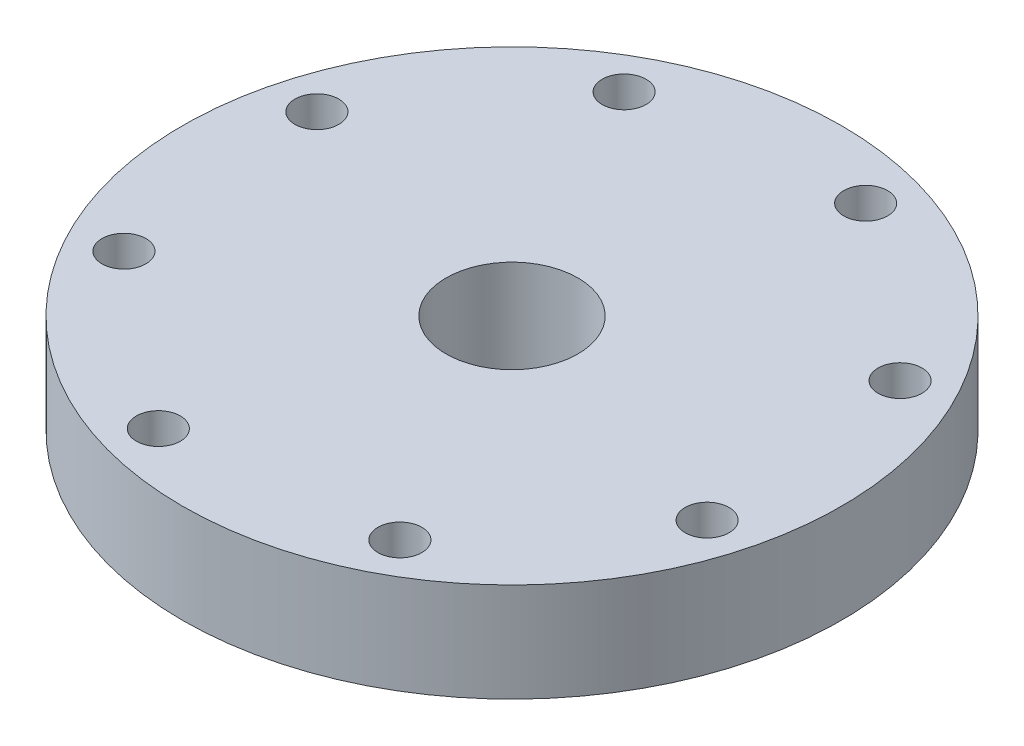
from build123d import *

# Parameters (mm, degrees)
SKETCH_1_R          = 15
EXTRUDE_1_DEPTH     = 2.25
SKETCH_3_R          = 1
CUT_EXTRUDE_1_DEPTH = 5
SKETCH_4_R          = 3
CUT_EXTRUDE_2_DEPTH = 4.5


with BuildPart() as part:
    # ｽｹｯﾁ1 → ﾎﾞｽ - 押し出し1 (new, symmetric)
    with BuildSketch(Plane(origin=(0, 0, 0), x_dir=(1, 0, 0), z_dir=(0, 1, 0))):
        with Locations(Location((0, 0, 0), (0, 0, 270))):
            Circle(SKETCH_1_R)
    extrude(amount=EXTRUDE_1_DEPTH, both=True)

    # ｽｹｯﾁ3 → ｶｯﾄ - 押し出し1 (cut)
    with BuildSketch(Plane(origin=(0, 2.25, 0), x_dir=(1, 0, 0), z_dir=(0, 1, 0))):
        with Locations(Location((-11.382561056, -6.279912723, 0), (0, 0, 270))):
            Circle(SKETCH_3_R)
        with Locations(Location((-12.489254982, 3.608117238, 0), (0, 0, 270))):
            Circle(SKETCH_3_R)
        with Locations(Location((-6.279912723, 11.382561056, 0), (0, 0, 270))):
            Circle(SKETCH_3_R)
        with Locations(Location((3.608117238, 12.489254982, 0), (0, 0, 270))):
            Circle(SKETCH_3_R)
        with Locations(Location((11.382561056, 6.279912723, 0), (0, 0, 270))):
            Circle(SKETCH_3_R)
        with Locations(Location((12.489254982, -3.608117238, 0), (0, 0, 270))):
            Circle(SKETCH_3_R)
        with Locations(Location((6.279912723, -11.382561056, 0), (0, 0, 270))):
            Circle(SKETCH_3_R)
        with Locations(Location((-3.608117238, -12.489254982, 0), (0, 0, 270))):
            Circle(SKETCH_3_R)
    extrude(amount=-CUT_EXTRUDE_1_DEPTH, mode=Mode.SUBTRACT)

    # ｽｹｯﾁ4 → ｶｯﾄ - 押し出し2 (cut)
    with BuildSketch(Plane.XZ.offset(2.25)):
        with Locations(Location((0, 0, 0), (0, 0, 270))):
            Circle(SKETCH_4_R)
    extrude(amount=-CUT_EXTRUDE_2_DEPTH, mode=Mode.SUBTRACT)


solid = part.part
